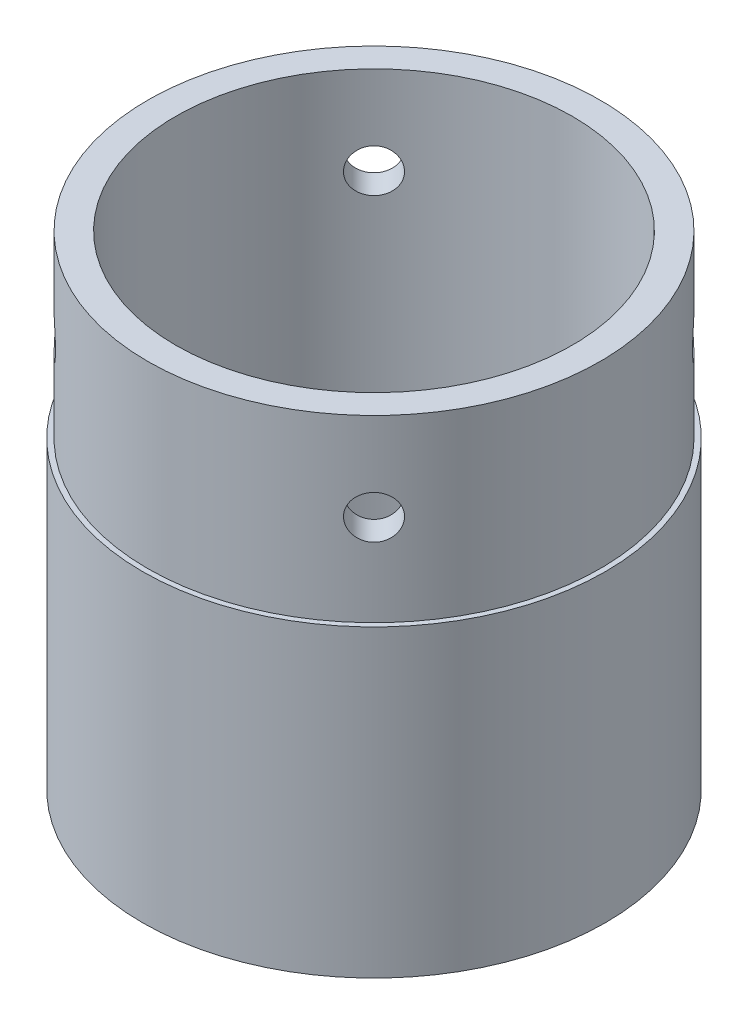
from build123d import *
from build123d.topology import SkipClean

# Parameters (mm, degrees)
SKETCH1_R               = 37.2
SKETCH1_R_2             = 32.6
BOSS_EXTRUDE1_DEPTH     = 29.5
CUT_EXTRUDE1_REACH      = 96.53
CUT_EXTRUDE1_END_RADIUS = 32.6
SKETCH2_R               = 3.55
CIRPATTERN1_COUNT       = 4
BOSS_EXTRUDE2_START     = 50
SKETCH3_R               = 38.05
SKETCH3_R_2             = 32.6
BOSS_EXTRUDE2_DEPTH     = 50


with BuildPart() as part:
    # Sketch1 → Boss-Extrude1 (new body)
    with BuildSketch(Plane(origin=(0, 0, 0), x_dir=(1, 0, 0), z_dir=(0, 1, 0))):
        with Locations(Location((0, 0, 0), (0, 0, 270))):
            Circle(SKETCH1_R)
        with Locations(Location((0, 0, 0), (0, 0, 270))):
            Circle(SKETCH1_R_2, mode=Mode.SUBTRACT)
    extrude(amount=BOSS_EXTRUDE1_DEPTH)

    # Cut-Extrude1: up to this cylinder (the profile starts outside it)
    cut_extrude1_end = Plane(origin=(0, 15, 0), z_dir=(0, -1, 0)) * Cylinder(CUT_EXTRUDE1_END_RADIUS, 259.26, mode=Mode.PRIVATE)
    # Sketch2 → Cut-Extrude1 (cut, up to the surface)
    with BuildSketch(Plane(origin=(-26.30437226, 0, -26.30437226), x_dir=(0, -1, 0), z_dir=(-0.7071067811865464, 0, -0.7071067811865488)), mode=Mode.PRIVATE) as cut_extrude1_sk1:
        with Locations(Location((-15, 0, 0), (0, 0, 90))):
            Circle(SKETCH2_R)
    cut_extrude1_tool1 = extrude(cut_extrude1_sk1.sketch, amount=-CUT_EXTRUDE1_REACH, mode=Mode.PRIVATE) - cut_extrude1_end
    cut_extrude1 = cut_extrude1_tool1.solids().sort_by_distance((-26.304372, 15, -26.304372))[0]
    add(cut_extrude1, mode=Mode.SUBTRACT)

    # CirPattern1: Cut-Extrude1 ×4 about axis
    cirpattern1_axis = Axis((0, 29.5, 0), (0, -1, 0))
    for i in range(1, CIRPATTERN1_COUNT):
        add(cut_extrude1.rotate(cirpattern1_axis, i * 360 / CIRPATTERN1_COUNT), mode=Mode.SUBTRACT)

    # Sketch3 → Boss-Extrude2 (add)
    with SkipClean():  # the faces are left unmerged after this step: merging them gives an invalid solid
        with BuildSketch(Plane.XZ.offset(BOSS_EXTRUDE2_START)):
            with Locations(Location((0, 0, 0), (0, 0, 270))):
                Circle(SKETCH3_R)
            with Locations(Location((0, 0, 0), (0, 0, 270))):
                Circle(SKETCH3_R_2, mode=Mode.SUBTRACT)
        extrude(amount=-BOSS_EXTRUDE2_DEPTH)


solid = part.part
